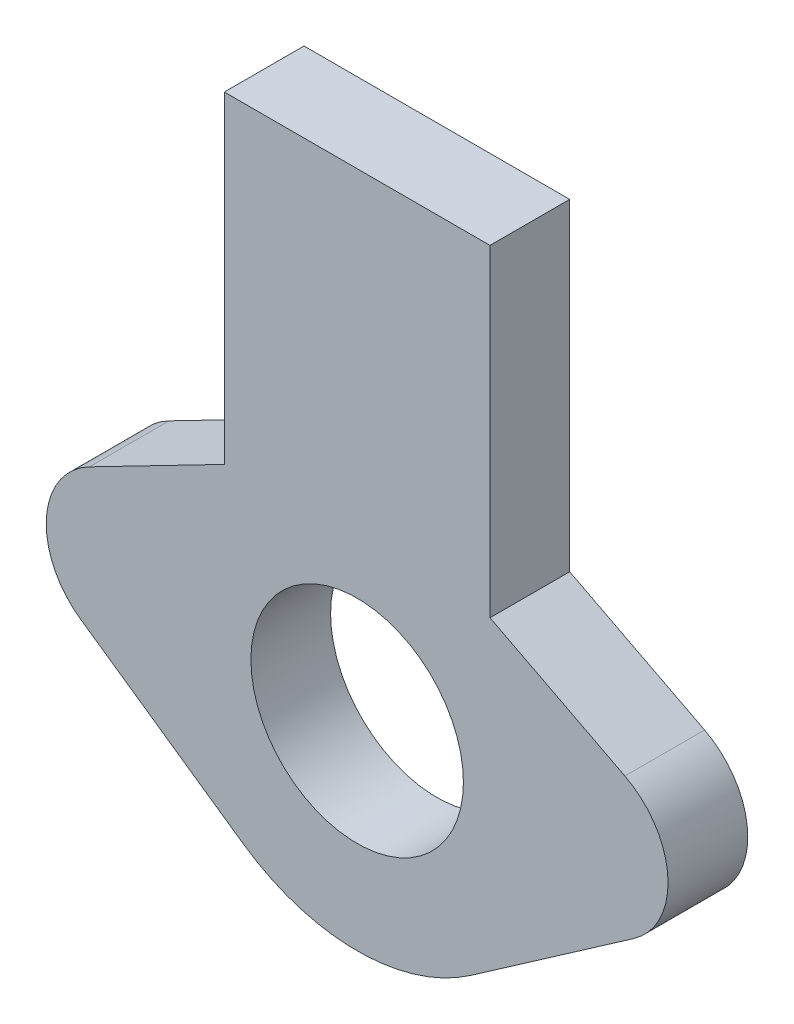
from build123d import *

# Parameters (mm, degrees)
SKETCH1_R           = 4
BOSS_EXTRUDE1_DEPTH = 3
BOSS_EXTRUDE2_DEPTH = 3
FILLET1_R           = 3


with BuildPart() as part:
    # Sketch1 → Boss-Extrude1 (new body)
    with BuildSketch(Plane.XY):
        with BuildLine():
            Line((-5, 5.590169944), (-5, 18))
            Line((-5, 18), (5, 18))
            Line((5, 18), (5, 5.590169944))
            ThreePointArc((5, 5.590169944), (0, -7.5), (-5, 5.590169944))
        make_face()
        Circle(SKETCH1_R, mode=Mode.SUBTRACT)
    extrude(amount=BOSS_EXTRUDE1_DEPTH)

    # Sketch2 → Boss-Extrude2 (add)
    with BuildSketch(Plane(origin=(0, 0, 0), x_dir=(-1, 0, 0), z_dir=(0, 0, -1))):
        with BuildLine():
            Line((-4.283653157, -6.156323223), (-14.506679921, 0.956997388))
            Line((-14.506679921, 0.956997388), (-3.437791444, 6.665702513))
            ThreePointArc((-3.437791444, 6.665702513), (-7.483733204, 0.493697605), (-4.283653157, -6.156323223))
        make_face()
        with BuildLine():
            Line((4.283653157, -6.156323223), (14.506679921, 0.956997388))
            Line((14.506679921, 0.956997388), (3.437791444, 6.665702513))
            ThreePointArc((3.437791444, 6.665702513), (7.483733204, 0.493697605), (4.283653157, -6.156323223))
        make_face()
    extrude(amount=-BOSS_EXTRUDE2_DEPTH)

    # Fillet1
    fillet1_edges = [part.edges().sort_by_distance(p)[0] for p in [
        (14.506679921, 0.956997388, 1.5),
        (-14.506679921, 0.956997388, 1.5),
    ]]
    fillet(fillet1_edges, radius=FILLET1_R)


solid = part.part
